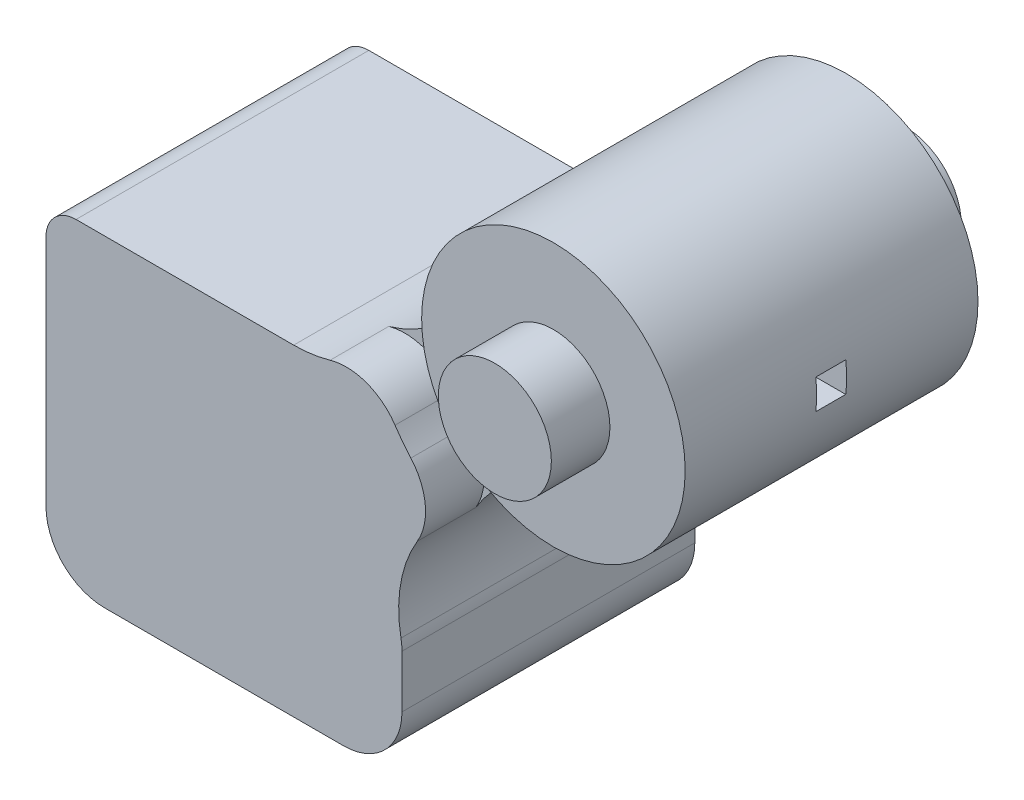
from build123d import *
from build123d.topology import SkipClean

# Parameters (mm, degrees)
SKETCH3_R                = 1.5319375
BOSS_EXTRUDE1_DEPTH      = 7.9375
BOSS_EXTRUDE2_DEPTH      = 9.525
BOSS_EXTRUDE2_DEPTH_BACK = 1.5875
SKETCH3_4_R              = 1.5319375
FILLET1_R                = 1.5875
SKETCH4_W                = 1.5875
SKETCH4_H                = 4.7625
CUT_EXTRUDE1_DEPTH       = 3.175
SKETCH5_W                = 4.7752
SKETCH5_H                = 1.5875
CUT_EXTRUDE2_DEPTH       = 3.175
FILLET2_R                = 3.571875
SKETCH6_W                = 0.8128
SKETCH6_H                = 0.8128
CUT_EXTRUDE4_DEPTH       = 0.89281
CUT_EXTRUDE6_START       = -1.5875
CUT_EXTRUDE6_DEPTH       = 1.5875
CUT_EXTRUDE7_START       = -7.9375
CUT_EXTRUDE7_DEPTH       = 1.5875
FILLET4_R                = 1.5875


with BuildPart() as part:
    # Sketch3 → Boss-Extrude1 (new body)
    with BuildSketch(Plane.XY):
        with BuildLine():
            ThreePointArc((0.813693974, 5.55625), (0.238325447, 5.317924553), (0, 4.742556026))
            Line((0, 4.742556026), (0, -3.175))
            Line((0, -3.175), (9.649461258, -3.175))
            Line((9.649461258, -3.175), (9.649461258, 0))
            ThreePointArc((9.649461258, 0), (10.438552252, 3.141997614), (13.44291972, 4.353851449))
            ThreePointArc((13.44291972, 4.353851449), (15.368414392, 11.098464078), (11.069438658, 5.55625))
            Line((11.069438658, 5.55625), (0.813693974, 5.55625))
        make_face()
        with Locations((13.754229109, 7.912134389)):
            Circle(SKETCH3_R, mode=Mode.SUBTRACT)
    extrude(amount=BOSS_EXTRUDE1_DEPTH)

    # Sketch3<4> → Boss-Extrude2 (add, two sides: drawn at the far end of the back side and taken through both)
    with BuildSketch(Plane.XY.offset(-BOSS_EXTRUDE2_DEPTH_BACK)):
        with Locations((13.754229109, 7.912134389)):
            Circle(SKETCH3_4_R)
    extrude(amount=BOSS_EXTRUDE2_DEPTH + BOSS_EXTRUDE2_DEPTH_BACK)

    # Fillet1
    fillet1_edges = [part.edges().sort_by_distance(p)[0] for p in [
        (9.649461258, 0, 3.96875),
        (9.649461258, -3.175, 3.96875),
        (0, -3.175, 3.96875),
    ]]
    fillet(fillet1_edges, radius=FILLET1_R)

    # Sketch4 → Cut-Extrude1 (cut)
    with BuildSketch(Plane.XZ.offset(3.175)):
        with Locations((4.824730629, 3.96875)):
            Rectangle(SKETCH4_W, SKETCH4_H)
    extrude(amount=-CUT_EXTRUDE1_DEPTH, mode=Mode.SUBTRACT)

    # Sketch5 → Cut-Extrude2 (cut)
    with BuildSketch(Plane.ZY):
        with Locations((3.96875, 1.577528013)):
            Rectangle(SKETCH5_W, SKETCH5_H)
    extrude(amount=-CUT_EXTRUDE2_DEPTH, mode=Mode.SUBTRACT)

    # Fillet2
    fillet2_edges = [part.edges().sort_by_distance(p)[0] for p in [
        (11.069438658, 5.55625, 3.96875),
    ]]
    fillet(fillet2_edges, radius=FILLET2_R)

    # Sketch6 → Cut-Extrude4 (cut)
    with BuildSketch(Plane(origin=(17.326104109, 0, 0), x_dir=(0, 0, -1), z_dir=(1, 0, 0))):
        with Locations((-3.96875, 7.912134389)):
            Rectangle(SKETCH6_W, SKETCH6_H)
    extrude(amount=-CUT_EXTRUDE4_DEPTH, mode=Mode.SUBTRACT)

    # Sketch7 → Cut-Extrude6 (cut)
    with SkipClean():  # the faces are left unmerged after this step: merging them gives an invalid solid
        with BuildSketch(Plane.XY.offset(7.9375).offset(CUT_EXTRUDE6_START)):
            with BuildLine():
                ThreePointArc((13.44291969, 4.353851452), (10.924260793, 5.732783489), (10.234480151, 8.520129694))
                ThreePointArc((10.234480151, 8.520129694), (9.762713445, 7.265842741), (8.861926483, 6.273682251))
                ThreePointArc((8.861926483, 6.273682251), (9.666497097, 4.764183089), (10.920382704, 3.600700179))
                ThreePointArc((10.920382704, 3.600700179), (12.109733834, 4.218149348), (13.44291969, 4.353851452))
            make_face()
        extrude(amount=CUT_EXTRUDE6_DEPTH, mode=Mode.SUBTRACT)

    # Sketch7<6> → Cut-Extrude7 (cut)
    with SkipClean():  # the faces are left unmerged after this step: merging them gives an invalid solid
        with BuildSketch(Plane.XY.offset(7.9375).offset(CUT_EXTRUDE7_START)):
            with BuildLine():
                ThreePointArc((13.44291969, 4.353851452), (10.924260793, 5.732783489), (10.234480151, 8.520129694))
                ThreePointArc((10.234480151, 8.520129694), (9.762713445, 7.265842741), (8.861926483, 6.273682251))
                ThreePointArc((8.861926483, 6.273682251), (9.666497097, 4.764183089), (10.920382704, 3.600700179))
                ThreePointArc((10.920382704, 3.600700179), (12.109733834, 4.218149348), (13.44291969, 4.353851452))
            make_face()
        extrude(amount=CUT_EXTRUDE7_DEPTH, mode=Mode.SUBTRACT)

    # Fillet4
    fillet4_edges = [part.edges().sort_by_distance(p)[0] for p in [
        (10.920382704, 3.600700179, 0.79375),
        (10.920382704, 3.600700179, 7.14375),
        (8.861926483, 6.273682251, 7.14375),
        (8.861926483, 6.273682251, 0.79375),
    ]]
    fillet(fillet4_edges, radius=FILLET4_R)


solid = part.part
